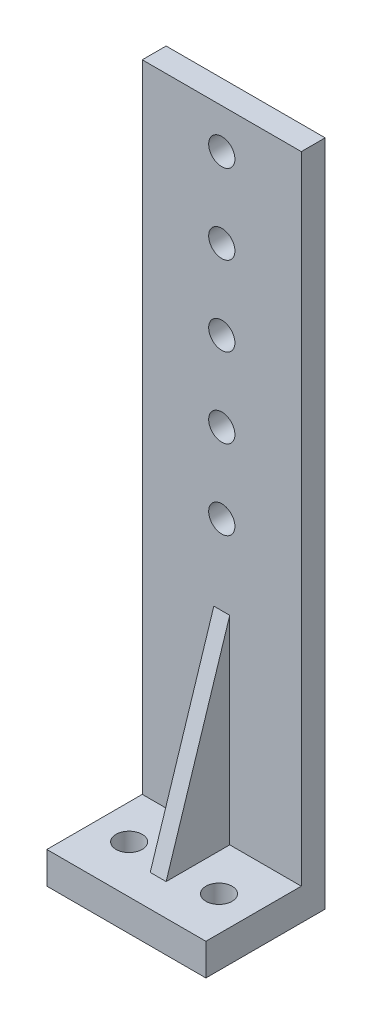
from build123d import *

# Parameters (mm, degrees)
SKETCH_1_W           = 20
SKETCH_1_H           = 12
SKETCH_1_R           = 1.65
EXTRUDE_1_DEPTH      = 4
SKETCH_2_W           = 20
SKETCH_2_H           = 3
EXTRUDE_2_DEPTH      = 84
EXTRUDE_3_DEPTH      = 1
EXTRUDE_3_DEPTH_BACK = 1
SKETCH_4_R           = 1.65
CUT_EXTRUDE_1_DEPTH  = 3


with BuildPart() as part:
    # 草图1 → 凸台-拉伸1 (new body)
    with BuildSketch(Plane(origin=(0, 0, 0), x_dir=(1, 0, 0), z_dir=(0, 1, 0))):
        Rectangle(SKETCH_1_W, SKETCH_1_H)
        with Locations(Location((-5.65, 0, 0), (0, 0, 270))):
            Circle(SKETCH_1_R, mode=Mode.SUBTRACT)
        with Locations(Location((5.65, 0, 0), (0, 0, 270))):
            Circle(SKETCH_1_R, mode=Mode.SUBTRACT)
    extrude(amount=EXTRUDE_1_DEPTH)

    # 草图2 → 凸台-拉伸2 (add)
    with BuildSketch(Plane(origin=(0, 0, 0), x_dir=(1, 0, 0), z_dir=(0, 1, 0))):
        with Locations((0, 7.5)):
            Rectangle(SKETCH_2_W, SKETCH_2_H)
    extrude(amount=EXTRUDE_2_DEPTH)

    # 草图3 → 凸台-拉伸3 (add, two sides: drawn at the far end of the back side and taken through both)
    with BuildSketch(Plane(origin=(0, 0, 0), x_dir=(0, 0, -1), z_dir=(1, 0, 0)).offset(-EXTRUDE_3_DEPTH_BACK)):
        Polygon((-2, 4), (6, 4), (6, 29), align=None)
    extrude(amount=EXTRUDE_3_DEPTH + EXTRUDE_3_DEPTH_BACK)

    # 草图4 → 切除-拉伸1 (cut)
    with BuildSketch(Plane.XY.offset(-6)):
        with Locations((0, 39)):
            Circle(SKETCH_4_R)
        with Locations((0, 49)):
            Circle(SKETCH_4_R)
        with Locations((0, 59)):
            Circle(SKETCH_4_R)
        with Locations((0, 69)):
            Circle(SKETCH_4_R)
        with Locations((0, 79)):
            Circle(SKETCH_4_R)
    extrude(amount=-CUT_EXTRUDE_1_DEPTH, mode=Mode.SUBTRACT)


solid = part.part
